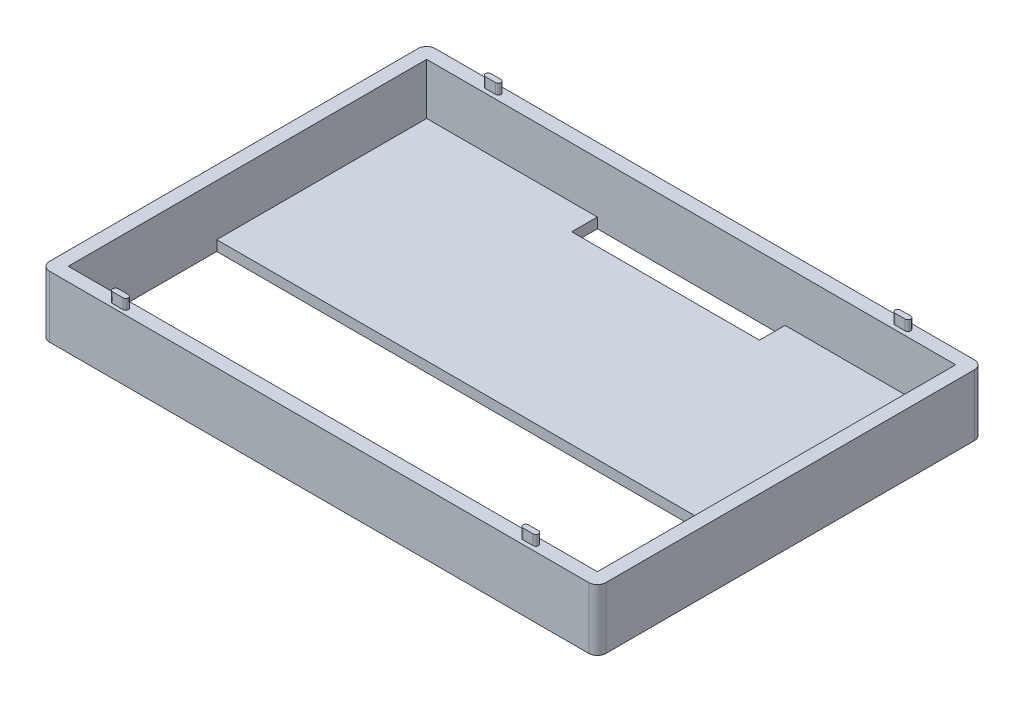
from build123d import *

# Parameters (mm, degrees)
SKETCH3_W            = 163
SKETCH3_H            = 113
BOSS_EXTRUDE2_DEPTH  = 18
SKETCH4_W            = 155
SKETCH4_H            = 105
CUT_EXTRUDE2_DEPTH   = 15
FILLET1_R            = 2.5
SKETCH5_W            = 55
SKETCH5_H            = 7.5
TOPWIRES_DEPTH       = 3
SKETCH6_W            = 155
SKETCH6_H            = 43.5
MOTORWIRES_DEPTH     = 3
CONNECTORHOLES_DEPTH = 3
SKETCH14_W           = 10
SKETCH14_H           = 22
SIDEWIRES_DEPTH      = 3
BOSS_EXTRUDE7_DEPTH  = 3


with BuildPart() as part:
    # Sketch3 → Boss-Extrude2 (new body)
    with BuildSketch(Plane(origin=(0, 0, 0), x_dir=(1, 0, 0), z_dir=(0, 1, 0))):
        Rectangle(SKETCH3_W, SKETCH3_H)
    extrude(amount=BOSS_EXTRUDE2_DEPTH)

    # Sketch4 → Cut-Extrude2 (cut)
    with BuildSketch(Plane(origin=(0, 18, 0), x_dir=(1, 0, 0), z_dir=(0, 1, 0))):
        Rectangle(SKETCH4_W, SKETCH4_H)
    extrude(amount=-CUT_EXTRUDE2_DEPTH, mode=Mode.SUBTRACT)

    # Fillet1
    fillet1_edges = [part.edges().sort_by_distance(p)[0] for p in [
        (81.5, 9, 56.5),
        (-81.5, 9, 56.5),
        (-81.5, 9, -56.5),
        (81.5, 9, -56.5),
    ]]
    fillet(fillet1_edges, radius=FILLET1_R)

    # Sketch5 → TopWires (cut)
    with BuildSketch(Plane(origin=(0, 3, 0), x_dir=(1, 0, 0), z_dir=(0, 1, 0))):
        with Locations((0, 48.75)):
            Rectangle(SKETCH5_W, SKETCH5_H)
    extrude(amount=-TOPWIRES_DEPTH, mode=Mode.SUBTRACT)

    # Sketch6 → MotorWires (cut)
    with BuildSketch(Plane(origin=(0, 3, 0), x_dir=(1, 0, 0), z_dir=(0, 1, 0))):
        with Locations((0, -30.75)):
            Rectangle(SKETCH6_W, SKETCH6_H)
    extrude(amount=-MOTORWIRES_DEPTH, mode=Mode.SUBTRACT)

    # Sketch13 → ConnectorHoles (cut)
    with BuildSketch(Plane(origin=(0, 0, 0), x_dir=(-1, 0, 0), z_dir=(0, -1, 0))):
        with BuildLine():
            Line((61.5, 53.5), (58.5, 53.5))
            ThreePointArc((58.5, 53.5), (57.5, 54.5), (58.5, 55.5))
            Line((58.5, 55.5), (61.5, 55.5))
            ThreePointArc((61.5, 55.5), (62.5, 54.5), (61.5, 53.5))
        make_face()
        with BuildLine():
            Line((-58.5, 53.5), (-61.5, 53.5))
            ThreePointArc((-61.5, 53.5), (-62.5, 54.5), (-61.5, 55.5))
            Line((-61.5, 55.5), (-58.5, 55.5))
            ThreePointArc((-58.5, 55.5), (-57.5, 54.5), (-58.5, 53.5))
        make_face()
        with BuildLine():
            Line((61.5, -55.5), (58.5, -55.5))
            ThreePointArc((58.5, -55.5), (57.5, -54.5), (58.5, -53.5))
            Line((58.5, -53.5), (61.5, -53.5))
            ThreePointArc((61.5, -53.5), (62.5, -54.5), (61.5, -55.5))
        make_face()
        with BuildLine():
            Line((-61.5, -53.5), (-58.5, -53.5))
            ThreePointArc((-58.5, -53.5), (-57.5, -54.5), (-58.5, -55.5))
            Line((-58.5, -55.5), (-61.5, -55.5))
            ThreePointArc((-61.5, -55.5), (-62.5, -54.5), (-61.5, -53.5))
        make_face()
    extrude(amount=-CONNECTORHOLES_DEPTH, mode=Mode.SUBTRACT)

    # Sketch14 → SideWires (cut)
    with BuildSketch(Plane(origin=(0, 3, 0), x_dir=(1, 0, 0), z_dir=(0, 1, 0))):
        with Locations((72.5, 2)):
            Rectangle(SKETCH14_W, SKETCH14_H)
    extrude(amount=-SIDEWIRES_DEPTH, mode=Mode.SUBTRACT)

    # Sketch16 → Boss-Extrude7 (add)
    with BuildSketch(Plane(origin=(0, 18, 0), x_dir=(1, 0, 0), z_dir=(0, 1, 0))):
        with BuildLine():
            Line((61.5, -55.3), (58.5, -55.3))
            ThreePointArc((58.5, -55.3), (57.7, -54.5), (58.5, -53.7))
            Line((58.5, -53.7), (61.5, -53.7))
            ThreePointArc((61.5, -53.7), (62.3, -54.5), (61.5, -55.3))
        make_face()
        with BuildLine():
            Line((-58.5, -55.491947616), (-61.5, -55.491947616))
            ThreePointArc((-61.5, -55.491947616), (-62.3, -54.691947616), (-61.5, -53.891947616))
            Line((-61.5, -53.891947616), (-58.5, -53.891947616))
            ThreePointArc((-58.5, -53.891947616), (-57.7, -54.691947616), (-58.5, -55.491947616))
        make_face()
        with BuildLine():
            Line((-61.5, 55.3), (-58.5, 55.3))
            ThreePointArc((-58.5, 55.3), (-57.7, 54.5), (-58.5, 53.7))
            Line((-58.5, 53.7), (-61.5, 53.7))
            ThreePointArc((-61.5, 53.7), (-62.3, 54.5), (-61.5, 55.3))
        make_face()
        with BuildLine():
            Line((61.5, 53.7), (58.5, 53.7))
            ThreePointArc((58.5, 53.7), (57.7, 54.5), (58.5, 55.3))
            Line((58.5, 55.3), (61.5, 55.3))
            ThreePointArc((61.5, 55.3), (62.3, 54.5), (61.5, 53.7))
        make_face()
    extrude(amount=BOSS_EXTRUDE7_DEPTH)


solid = part.part
